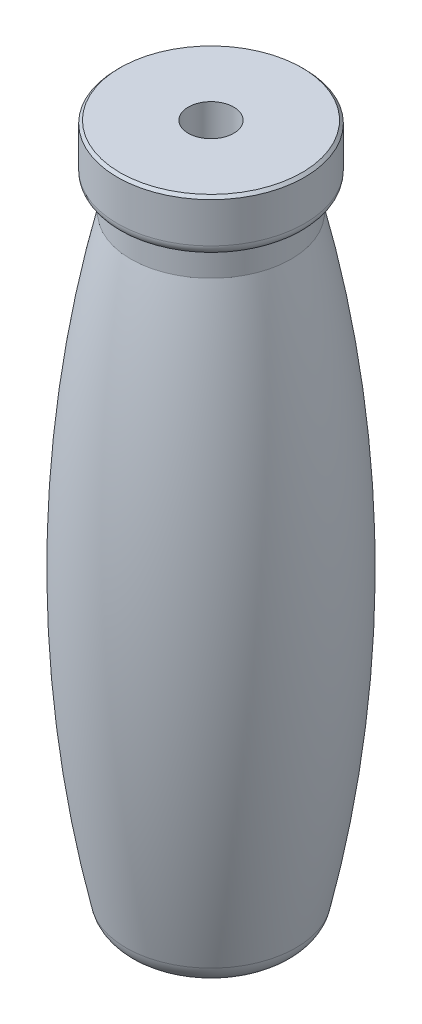
from build123d import *

# Parameters (mm, degrees)
SKETCH1_R           = 17.5
BOSS_EXTRUDE1_DEPTH = 10
FILLET1_R           = 5
SKETCH3_R           = 7.5
CUT_EXTRUDE1_DEPTH  = 110
SKETCH4_R           = 4.25
CUT_EXTRUDE2_DEPTH  = 20
FILLET5_R           = 2
CHAMFER1_SIZE       = 0.5


with BuildPart() as part:
    # Sketch1 → Boss-Extrude1 (new body)
    with BuildSketch(Plane(origin=(0, 0, 0), x_dir=(1, 0, 0), z_dir=(0, 1, 0))):
        with Locations(Location((0, 0, 0), (0, 0, 270))):
            Circle(SKETCH1_R)
    extrude(amount=BOSS_EXTRUDE1_DEPTH)

    # Sketch2 → Revolve1 (revolve)
    with BuildSketch(Plane(origin=(0, 0, 0), x_dir=(0, 0, -1), z_dir=(1, 0, 0)), mode=Mode.PRIVATE) as revolve1_sk:
        with BuildLine():
            Line((15, 0), (15, -5))
            ThreePointArc((15, -5), (21.702342798, -62.5), (15, -120))
            Line((15, -120), (0, -120))
            Line((0, -120), (0, 0))
            Line((0, 0), (15, 0))
        make_face()
    revolve(revolve1_sk.sketch.rotate(Axis((0, 0, 0), (0, -1, 0)), 180), axis=Axis((0, 0, 0), (0, -1, 0)))

    # Fillet1
    fillet1_edges = [part.edges().sort_by_distance(p)[0] for p in [
        (0, -120, -15),
    ]]
    fillet(fillet1_edges, radius=FILLET1_R)

    # Sketch3 → Cut-Extrude1 (cut)
    with BuildSketch(Plane.XZ.offset(120)):
        with Locations(Location((0, 0, 0), (0, 0, 270))):
            Circle(SKETCH3_R)
    extrude(amount=-CUT_EXTRUDE1_DEPTH, mode=Mode.SUBTRACT)

    # Sketch4 → Cut-Extrude2 (cut)
    with BuildSketch(Plane(origin=(0, 10, 0), x_dir=(1, 0, 0), z_dir=(0, 1, 0))):
        with Locations(Location((0, 0, 0), (0, 0, 270))):
            Circle(SKETCH4_R)
    extrude(amount=-CUT_EXTRUDE2_DEPTH, mode=Mode.SUBTRACT)

    # Fillet5
    fillet5_edges = [part.edges().sort_by_distance(p)[0] for p in [
        (0, 0, -17.5),
    ]]
    fillet(fillet5_edges, radius=FILLET5_R)

    # Chamfer1
    chamfer1_edges = [part.edges().sort_by_distance(p)[0] for p in [
        (0, 10, -17.5),
    ]]
    chamfer(chamfer1_edges, length=CHAMFER1_SIZE)


solid = part.part
